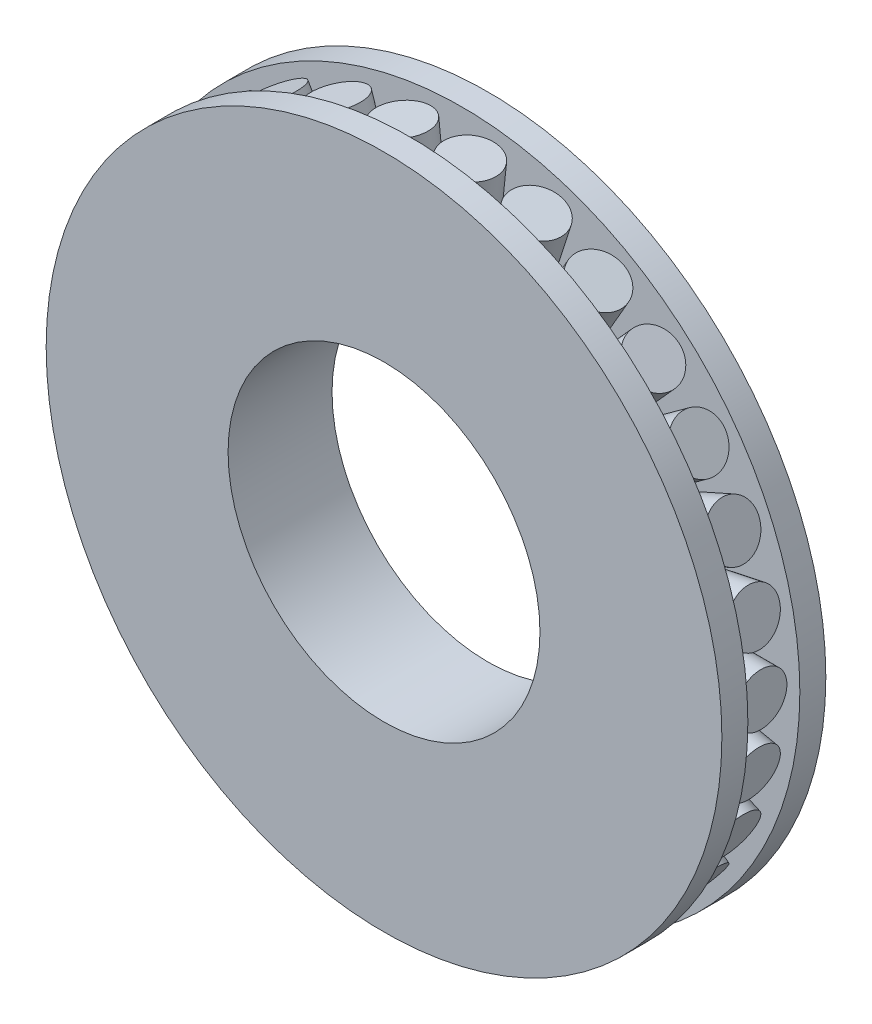
from build123d import *

# Parameters (mm, degrees)
SKETCH_1_R               = 13
SKETCH_1_R_2             = 6
EXTRUDE_1_DEPTH          = 4
CUT_EXTRUDE_1_DEPTH      = 1
CUT_EXTRUDE_1_DEPTH_BACK = 1
SKETCH_2_R               = 13
SKETCH_2_R_2             = 8
EXTRUDE_4_DEPTH          = 1.5
EXTRUDE_4_DEPTH_BACK     = 3
SKETCH_4_R               = 1.001861227
PATTERN_CIRCULAR_2_COUNT = 30


with BuildPart() as part:
    # 草图1 → 凸台-拉伸1 (new body)
    with BuildSketch(Plane.XY):
        Circle(SKETCH_1_R)
        Circle(SKETCH_1_R_2, mode=Mode.SUBTRACT)
    extrude(amount=EXTRUDE_1_DEPTH)

    # 草图2 → 切除-拉伸1 (cut, two sides: drawn at the far end of the back side and taken through both)
    with BuildSketch(Plane(origin=(0, 0, 2), x_dir=(-1, 0, 0), z_dir=(0, 0, -1)).offset(-CUT_EXTRUDE_1_DEPTH_BACK)):
        Circle(SKETCH_2_R)
        Circle(SKETCH_2_R_2, mode=Mode.SUBTRACT)
    extrude(amount=CUT_EXTRUDE_1_DEPTH + CUT_EXTRUDE_1_DEPTH_BACK, mode=Mode.SUBTRACT)


with BuildPart() as body_2:
    # 草图4 → 凸台-拉伸4 (new, two sides: drawn at the far end of the back side and taken through both)
    with BuildSketch(Plane(origin=(11, 0, 0), x_dir=(0, 0, -1), z_dir=(1, 0, 0)).offset(-EXTRUDE_4_DEPTH_BACK)):
        with Locations((-2, 0)):
            Circle(SKETCH_4_R)
    extrude(amount=EXTRUDE_4_DEPTH + EXTRUDE_4_DEPTH_BACK)


with BuildPart() as pattern_circular_2_1:
    # 阵列(圆周)2: pattern copy
    add(body_2.part.rotate(Axis((0, 0, 0), (0, 0, 1)), 1 * 360 / PATTERN_CIRCULAR_2_COUNT))


with BuildPart() as pattern_circular_2_2:
    # 阵列(圆周)2: pattern copy
    add(body_2.part.rotate(Axis((0, 0, 0), (0, 0, 1)), 2 * 360 / PATTERN_CIRCULAR_2_COUNT))


with BuildPart() as pattern_circular_2_3:
    # 阵列(圆周)2: pattern copy
    add(body_2.part.rotate(Axis((0, 0, 0), (0, 0, 1)), 3 * 360 / PATTERN_CIRCULAR_2_COUNT))


with BuildPart() as pattern_circular_2_4:
    # 阵列(圆周)2: pattern copy
    add(body_2.part.rotate(Axis((0, 0, 0), (0, 0, 1)), 4 * 360 / PATTERN_CIRCULAR_2_COUNT))


with BuildPart() as pattern_circular_2_5:
    # 阵列(圆周)2: pattern copy
    add(body_2.part.rotate(Axis((0, 0, 0), (0, 0, 1)), 5 * 360 / PATTERN_CIRCULAR_2_COUNT))


with BuildPart() as pattern_circular_2_6:
    # 阵列(圆周)2: pattern copy
    add(body_2.part.rotate(Axis((0, 0, 0), (0, 0, 1)), 6 * 360 / PATTERN_CIRCULAR_2_COUNT))


with BuildPart() as pattern_circular_2_7:
    # 阵列(圆周)2: pattern copy
    add(body_2.part.rotate(Axis((0, 0, 0), (0, 0, 1)), 7 * 360 / PATTERN_CIRCULAR_2_COUNT))


with BuildPart() as pattern_circular_2_8:
    # 阵列(圆周)2: pattern copy
    add(body_2.part.rotate(Axis((0, 0, 0), (0, 0, 1)), 8 * 360 / PATTERN_CIRCULAR_2_COUNT))


with BuildPart() as pattern_circular_2_9:
    # 阵列(圆周)2: pattern copy
    add(body_2.part.rotate(Axis((0, 0, 0), (0, 0, 1)), 9 * 360 / PATTERN_CIRCULAR_2_COUNT))


with BuildPart() as pattern_circular_2_10:
    # 阵列(圆周)2: pattern copy
    add(body_2.part.rotate(Axis((0, 0, 0), (0, 0, 1)), 10 * 360 / PATTERN_CIRCULAR_2_COUNT))


with BuildPart() as pattern_circular_2_11:
    # 阵列(圆周)2: pattern copy
    add(body_2.part.rotate(Axis((0, 0, 0), (0, 0, 1)), 11 * 360 / PATTERN_CIRCULAR_2_COUNT))


with BuildPart() as pattern_circular_2_12:
    # 阵列(圆周)2: pattern copy
    add(body_2.part.rotate(Axis((0, 0, 0), (0, 0, 1)), 12 * 360 / PATTERN_CIRCULAR_2_COUNT))


with BuildPart() as pattern_circular_2_13:
    # 阵列(圆周)2: pattern copy
    add(body_2.part.rotate(Axis((0, 0, 0), (0, 0, 1)), 13 * 360 / PATTERN_CIRCULAR_2_COUNT))


with BuildPart() as pattern_circular_2_14:
    # 阵列(圆周)2: pattern copy
    add(body_2.part.rotate(Axis((0, 0, 0), (0, 0, 1)), 14 * 360 / PATTERN_CIRCULAR_2_COUNT))


with BuildPart() as pattern_circular_2_15:
    # 阵列(圆周)2: pattern copy
    add(body_2.part.rotate(Axis((0, 0, 0), (0, 0, 1)), 15 * 360 / PATTERN_CIRCULAR_2_COUNT))


with BuildPart() as pattern_circular_2_16:
    # 阵列(圆周)2: pattern copy
    add(body_2.part.rotate(Axis((0, 0, 0), (0, 0, 1)), 16 * 360 / PATTERN_CIRCULAR_2_COUNT))


with BuildPart() as pattern_circular_2_17:
    # 阵列(圆周)2: pattern copy
    add(body_2.part.rotate(Axis((0, 0, 0), (0, 0, 1)), 17 * 360 / PATTERN_CIRCULAR_2_COUNT))


with BuildPart() as pattern_circular_2_18:
    # 阵列(圆周)2: pattern copy
    add(body_2.part.rotate(Axis((0, 0, 0), (0, 0, 1)), 18 * 360 / PATTERN_CIRCULAR_2_COUNT))


with BuildPart() as pattern_circular_2_19:
    # 阵列(圆周)2: pattern copy
    add(body_2.part.rotate(Axis((0, 0, 0), (0, 0, 1)), 19 * 360 / PATTERN_CIRCULAR_2_COUNT))


with BuildPart() as pattern_circular_2_20:
    # 阵列(圆周)2: pattern copy
    add(body_2.part.rotate(Axis((0, 0, 0), (0, 0, 1)), 20 * 360 / PATTERN_CIRCULAR_2_COUNT))


with BuildPart() as pattern_circular_2_21:
    # 阵列(圆周)2: pattern copy
    add(body_2.part.rotate(Axis((0, 0, 0), (0, 0, 1)), 21 * 360 / PATTERN_CIRCULAR_2_COUNT))


with BuildPart() as pattern_circular_2_22:
    # 阵列(圆周)2: pattern copy
    add(body_2.part.rotate(Axis((0, 0, 0), (0, 0, 1)), 22 * 360 / PATTERN_CIRCULAR_2_COUNT))


with BuildPart() as pattern_circular_2_23:
    # 阵列(圆周)2: pattern copy
    add(body_2.part.rotate(Axis((0, 0, 0), (0, 0, 1)), 23 * 360 / PATTERN_CIRCULAR_2_COUNT))


with BuildPart() as pattern_circular_2_24:
    # 阵列(圆周)2: pattern copy
    add(body_2.part.rotate(Axis((0, 0, 0), (0, 0, 1)), 24 * 360 / PATTERN_CIRCULAR_2_COUNT))


with BuildPart() as pattern_circular_2_25:
    # 阵列(圆周)2: pattern copy
    add(body_2.part.rotate(Axis((0, 0, 0), (0, 0, 1)), 25 * 360 / PATTERN_CIRCULAR_2_COUNT))


with BuildPart() as pattern_circular_2_26:
    # 阵列(圆周)2: pattern copy
    add(body_2.part.rotate(Axis((0, 0, 0), (0, 0, 1)), 26 * 360 / PATTERN_CIRCULAR_2_COUNT))


with BuildPart() as pattern_circular_2_27:
    # 阵列(圆周)2: pattern copy
    add(body_2.part.rotate(Axis((0, 0, 0), (0, 0, 1)), 27 * 360 / PATTERN_CIRCULAR_2_COUNT))


with BuildPart() as pattern_circular_2_28:
    # 阵列(圆周)2: pattern copy
    add(body_2.part.rotate(Axis((0, 0, 0), (0, 0, 1)), 28 * 360 / PATTERN_CIRCULAR_2_COUNT))


with BuildPart() as pattern_circular_2_29:
    # 阵列(圆周)2: pattern copy
    add(body_2.part.rotate(Axis((0, 0, 0), (0, 0, 1)), 29 * 360 / PATTERN_CIRCULAR_2_COUNT))


solid = Compound([part.part, body_2.part, pattern_circular_2_1.part, pattern_circular_2_2.part, pattern_circular_2_3.part, pattern_circular_2_4.part, pattern_circular_2_5.part, pattern_circular_2_6.part, pattern_circular_2_7.part, pattern_circular_2_8.part, pattern_circular_2_9.part, pattern_circular_2_10.part, pattern_circular_2_11.part, pattern_circular_2_12.part, pattern_circular_2_13.part, pattern_circular_2_14.part, pattern_circular_2_15.part, pattern_circular_2_16.part, pattern_circular_2_17.part, pattern_circular_2_18.part, pattern_circular_2_19.part, pattern_circular_2_20.part, pattern_circular_2_21.part, pattern_circular_2_22.part, pattern_circular_2_23.part, pattern_circular_2_24.part, pattern_circular_2_25.part, pattern_circular_2_26.part, pattern_circular_2_27.part, pattern_circular_2_28.part, pattern_circular_2_29.part])
